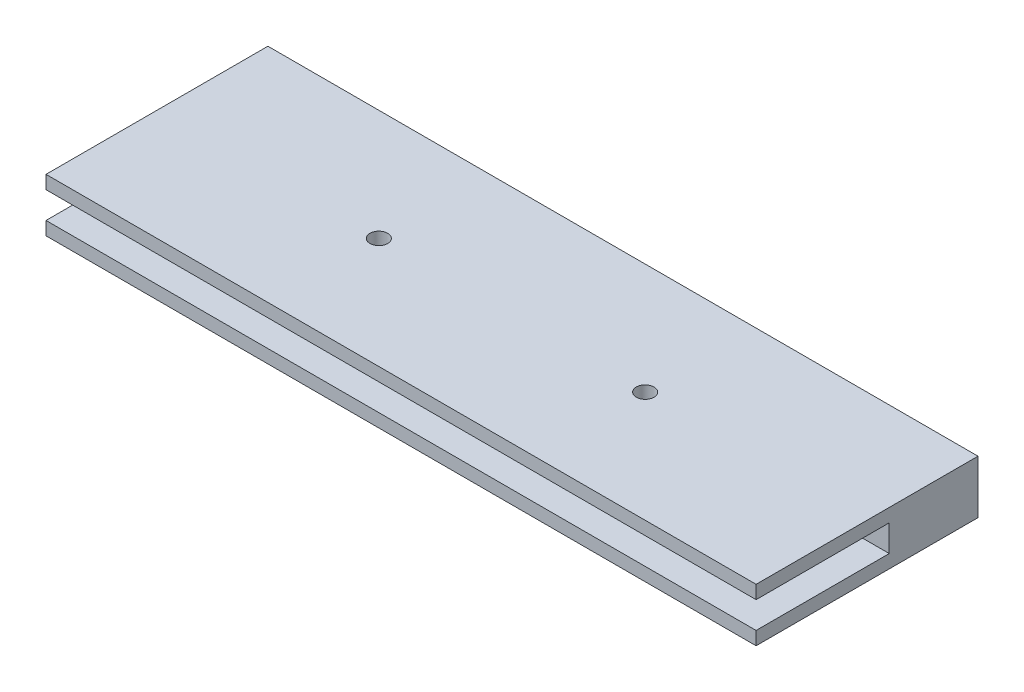
from build123d import *

# Parameters (mm, degrees)
CROQUIS1_W                 = 80
CROQUIS1_H                 = 6
SALIENTE_EXTRUIR4_DEPTH    = 10
CROQUIS5_W                 = 80
CROQUIS5_H                 = 6
SALIENTE_EXTRUIR6_DEPTH    = 10
CROQUIS7_W                 = 80
CROQUIS7_H                 = 1.5
SALIENTE_EXTRUIR7_DEPTH    = 10
CROQUIS9_W                 = 5
CROQUIS9_H                 = 3
CORTAR_EXTRUIR3_DEPTH      = 80
CROQUIS12_W                = 80
CROQUIS12_H                = 6
CORTAR_EXTRUIR4_DEPTH      = 10
CROQUIS13_W                = 80
CROQUIS13_H                = 6
SALIENTE_EXTRUIR8_DEPTH    = 5
CROQUIS14_R                = 1
CORTAR_EXTRUIR5_DEPTH      = 25
CROQUIS15_R                = 1
SALIENTE_EXTRUIR9_DEPTH    = 1
SALIENTE_EXTRUIR10_START   = -1
CROQUIS16_R                = 1
SALIENTE_EXTRUIR10_DEPTH   = 1
CORTAR_EXTRUIR6_DEPTH      = 86.650452421
CORTAR_EXTRUIR6_DEPTH_BACK = 25
CROQUIS17_R                = 1


with BuildPart() as part:
    # Croquis1 → Saliente-Extruir4 (new body)
    with BuildSketch(Plane.XY):
        with Locations((40, 3)):
            Rectangle(CROQUIS1_W, CROQUIS1_H)
    extrude(amount=SALIENTE_EXTRUIR4_DEPTH)

    # Croquis5 → Saliente-Extruir6 (add)
    with BuildSketch(Plane.XY.offset(10)):
        with Locations((40, 3)):
            Rectangle(CROQUIS5_W, CROQUIS5_H)
    extrude(amount=SALIENTE_EXTRUIR6_DEPTH)

    # Croquis7 → Saliente-Extruir7 (add)
    with BuildSketch(Plane.XY.offset(20)):
        with Locations((40, 5.25)):
            Rectangle(CROQUIS7_W, CROQUIS7_H)
        with Locations((40, 0.75)):
            Rectangle(CROQUIS7_W, CROQUIS7_H)
    extrude(amount=SALIENTE_EXTRUIR7_DEPTH)

    # Croquis9 → Cortar-Extruir3 (cut)
    with BuildSketch(Plane.ZY):
        with Locations((17.5, 3)):
            Rectangle(CROQUIS9_W, CROQUIS9_H)
    extrude(amount=-CORTAR_EXTRUIR3_DEPTH, mode=Mode.SUBTRACT)

    # Croquis12 → Cortar-Extruir4 (cut)
    with BuildSketch(Plane(origin=(0, 0, 0), x_dir=(-1, 0, 0), z_dir=(0, 0, -1))):
        with Locations((-40, 3)):
            Rectangle(CROQUIS12_W, CROQUIS12_H)
    extrude(amount=-CORTAR_EXTRUIR4_DEPTH, mode=Mode.SUBTRACT)

    # Croquis13 → Saliente-Extruir8 (add)
    with BuildSketch(Plane(origin=(0, 0, 10), x_dir=(-1, 0, 0), z_dir=(0, 0, -1))):
        with Locations((-40, 3)):
            Rectangle(CROQUIS13_W, CROQUIS13_H)
    extrude(amount=SALIENTE_EXTRUIR8_DEPTH)

    # Croquis14 → Cortar-Extruir5 (cut)
    with BuildSketch(Plane(origin=(0, 6, 0), x_dir=(1, 0, 0), z_dir=(0, 1, 0))):
        with Locations(Location((20, -17.5, 0), (0, 0, 270))):
            Circle(CROQUIS14_R)
        with Locations(Location((60, -17.5, 0), (0, 0, 270))):
            Circle(CROQUIS14_R)
    extrude(amount=-CORTAR_EXTRUIR5_DEPTH, mode=Mode.SUBTRACT)

    # Croquis15 → Saliente-Extruir9 (add)
    with BuildSketch(Plane(origin=(0, 6, 0), x_dir=(1, 0, 0), z_dir=(0, 1, 0))):
        with Locations(Location((20, -17.5, 0), (0, 0, 270))):
            Circle(CROQUIS15_R)
        with Locations(Location((60, -17.5, 0), (0, 0, 270))):
            Circle(CROQUIS15_R)
    extrude(amount=-SALIENTE_EXTRUIR9_DEPTH)

    # Croquis16 → Saliente-Extruir10 (add)
    with BuildSketch(Plane.XZ.offset(SALIENTE_EXTRUIR10_START)):
        with Locations(Location((20, 17.5, 0), (0, 0, 270))):
            Circle(CROQUIS16_R)
        with Locations(Location((60, 17.5, 0), (0, 0, 270))):
            Circle(CROQUIS16_R)
    extrude(amount=SALIENTE_EXTRUIR10_DEPTH)

    # Croquis17 → Cortar-Extruir6 (cut, two sides: drawn at the far end of the back side and taken through both)
    with BuildSketch(Plane(origin=(0, 6, 0), x_dir=(1, 0, 0), z_dir=(0, 1, 0)).offset(-CORTAR_EXTRUIR6_DEPTH_BACK)):
        with Locations(Location((25, -17.5, 0), (0, 0, 90))):
            Circle(CROQUIS17_R)
        with Locations(Location((55, -17.5, 0), (0, 0, 90))):
            Circle(CROQUIS17_R)
    extrude(amount=CORTAR_EXTRUIR6_DEPTH + CORTAR_EXTRUIR6_DEPTH_BACK, mode=Mode.SUBTRACT)


solid = part.part
